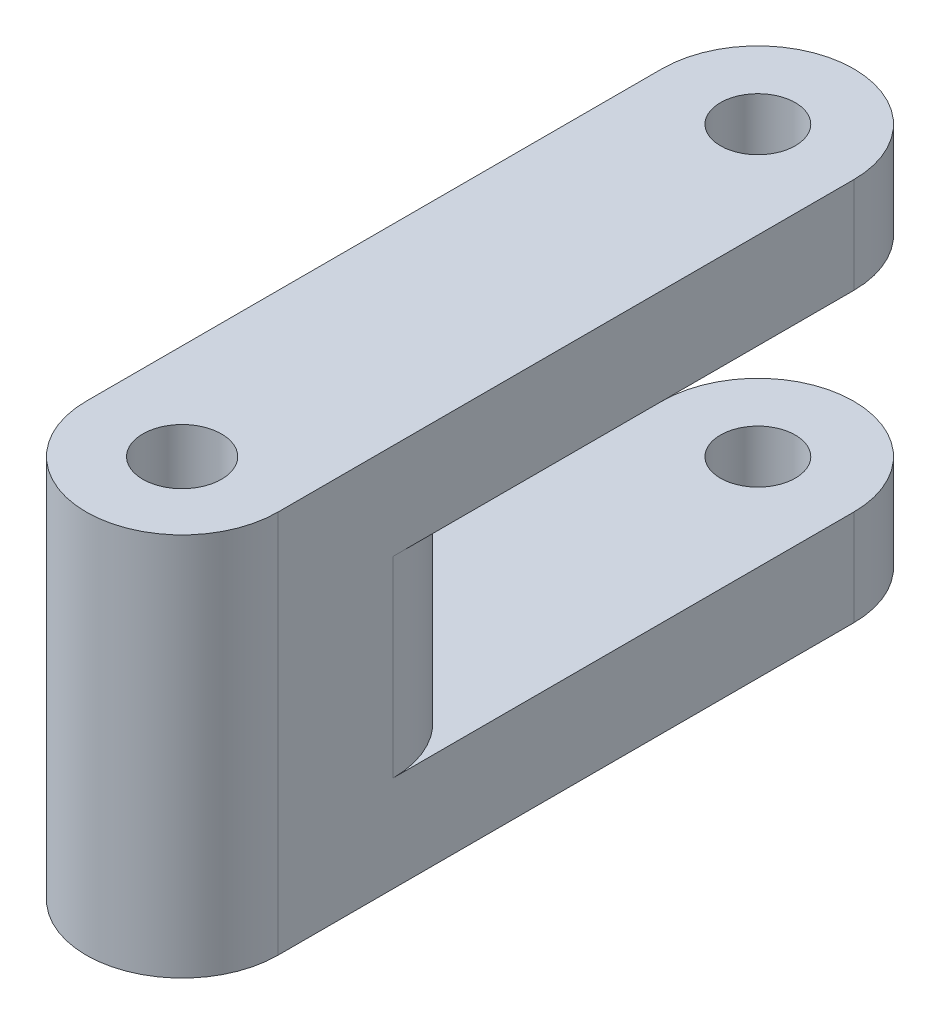
from build123d import *

# Parameters (mm, degrees)
ESQUISSE1_R        = 1.95
ESQUISSE1_R_2      = 2.05
BOSS_EXTRU_1_DEPTH = 5
ESQUISSE2_R        = 2.05
BOSS_EXTRU_2_DEPTH = 10
BOSS_EXTRU_3_START = 10
ESQUISSE3_R        = 1.95
ESQUISSE3_R_2      = 2.05
BOSS_EXTRU_3_DEPTH = 5


with BuildPart() as part:
    # Esquisse1 → Boss.-Extru.1 (new body)
    with BuildSketch(Plane(origin=(0, 0, 0), x_dir=(1, 0, 0), z_dir=(0, 1, 0))):
        with BuildLine():
            Line((-5, 0), (-5, 30))
            ThreePointArc((-5, 30), (0, 35), (5, 30))
            Line((5, 30), (5, 0))
            ThreePointArc((5, 0), (0, -5), (-5, 0))
        make_face()
        with Locations(Location((0, 30, 0), (0, 0, 270))):
            Circle(ESQUISSE1_R, mode=Mode.SUBTRACT)
        with Locations(Location((0, 0, 0), (0, 0, 270))):
            Circle(ESQUISSE1_R_2, mode=Mode.SUBTRACT)
    extrude(amount=BOSS_EXTRU_1_DEPTH)

    # Esquisse2 → Boss.-Extru.2 (add)
    with BuildSketch(Plane(origin=(0, 5, 0), x_dir=(1, 0, 0), z_dir=(0, 1, 0))):
        with BuildLine():
            Line((-5, 0), (-5, 6))
            ThreePointArc((-5, 6), (0, 11), (5, 6))
            Line((5, 6), (5, 0))
            ThreePointArc((5, 0), (0, -5), (-5, 0))
        make_face()
        with Locations(Location((0, 0, 0), (0, 0, 270))):
            Circle(ESQUISSE2_R, mode=Mode.SUBTRACT)
    extrude(amount=BOSS_EXTRU_2_DEPTH)

    # Esquisse3 → Boss.-Extru.3 (add)
    # profile 1 of 2: a face of its own
    with BuildSketch(Plane(origin=(0, 5, 0), x_dir=(1, 0, 0), z_dir=(0, 1, 0)).offset(BOSS_EXTRU_3_START)):
        with BuildLine():
            Line((-5, 30), (-5, 6))
            ThreePointArc((-5, 6), (0, 11), (5, 6))
            Line((5, 6), (5, 30))
            ThreePointArc((5, 30), (0, 35), (-5, 30))
        make_face()
        with Locations(Location((0, 30, 0), (0, 0, 270))):
            Circle(ESQUISSE3_R, mode=Mode.SUBTRACT)
    # profile 2 of 2: a face of its own
    with BuildSketch(Plane(origin=(0, 5, 0), x_dir=(1, 0, 0), z_dir=(0, 1, 0)).offset(BOSS_EXTRU_3_START)):
        with BuildLine():
            Line((-5, 6), (-5, 0))
            ThreePointArc((-5, 0), (0, -5), (5, 0))
            Line((5, 0), (5, 6))
            ThreePointArc((5, 6), (0, 11), (-5, 6))
        make_face()
        with Locations(Location((0, 0, 0), (0, 0, 270))):
            Circle(ESQUISSE3_R_2, mode=Mode.SUBTRACT)
    extrude(amount=BOSS_EXTRU_3_DEPTH)


solid = part.part
